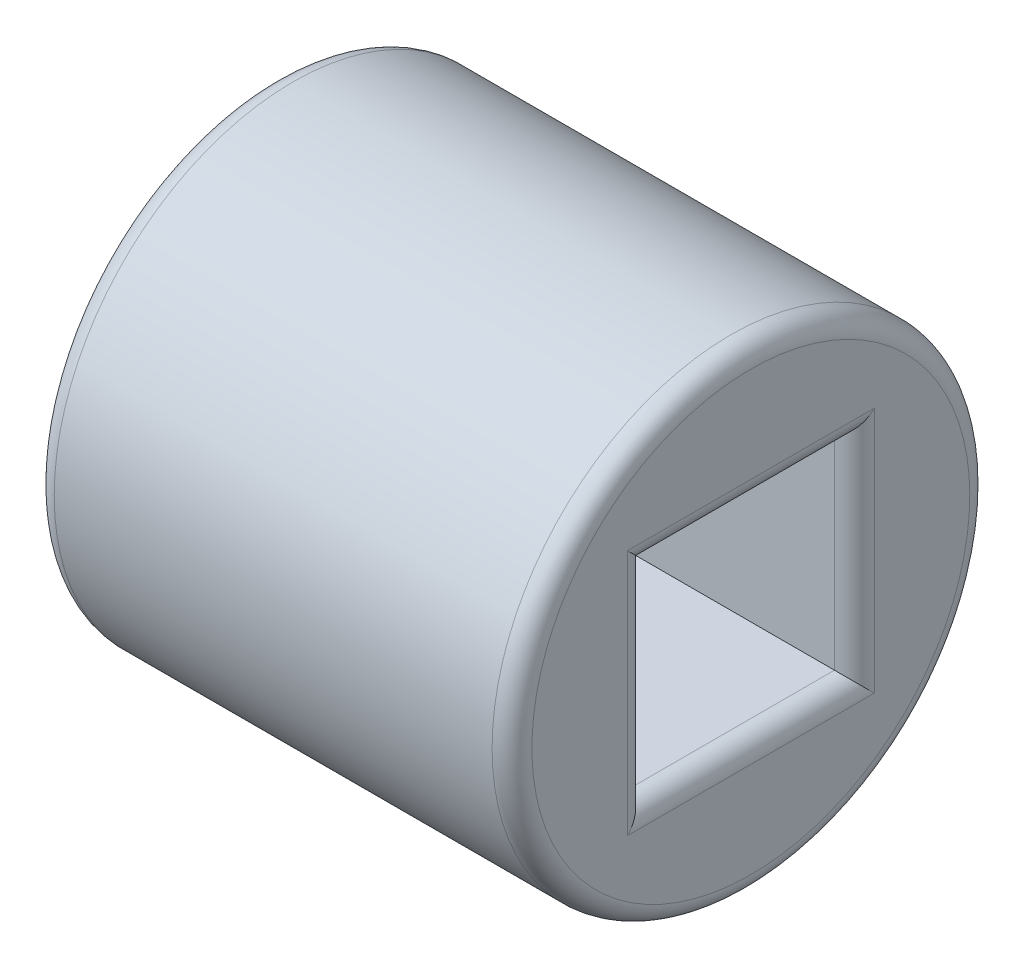
from build123d import *

# Parameters (mm, degrees)
SKETCH1_R           = 7.62
SKETCH1_W           = 6.604
SKETCH1_H           = 6.604
BOSS_EXTRUDE1_DEPTH = 15.24
FILLET1_R           = 0.635


with BuildPart() as part:
    # Sketch1 → Boss-Extrude1 (new body)
    with BuildSketch(Plane(origin=(0, 0, 0), x_dir=(0, 0, -1), z_dir=(1, 0, 0))):
        with Locations(Location((0, 0, 0), (0, 0, 180))):
            Circle(SKETCH1_R)
        Rectangle(SKETCH1_W, SKETCH1_H, mode=Mode.SUBTRACT)
    extrude(amount=BOSS_EXTRUDE1_DEPTH)

    # Fillet1
    fillet1_edges = [part.edges().sort_by_distance(p)[0] for p in [
        (15.24, 0, 3.302),
        (15.24, -3.302, 0),
        (0, 0, -7.62),
        (15.24, 0, -7.62),
        (0, 0, -3.302),
        (0, 3.302, 0),
        (0, 0, 3.302),
        (0, -3.302, 0),
        (15.24, 0, -3.302),
        (15.24, 3.302, 0),
    ]]
    fillet(fillet1_edges, radius=FILLET1_R)


solid = part.part
